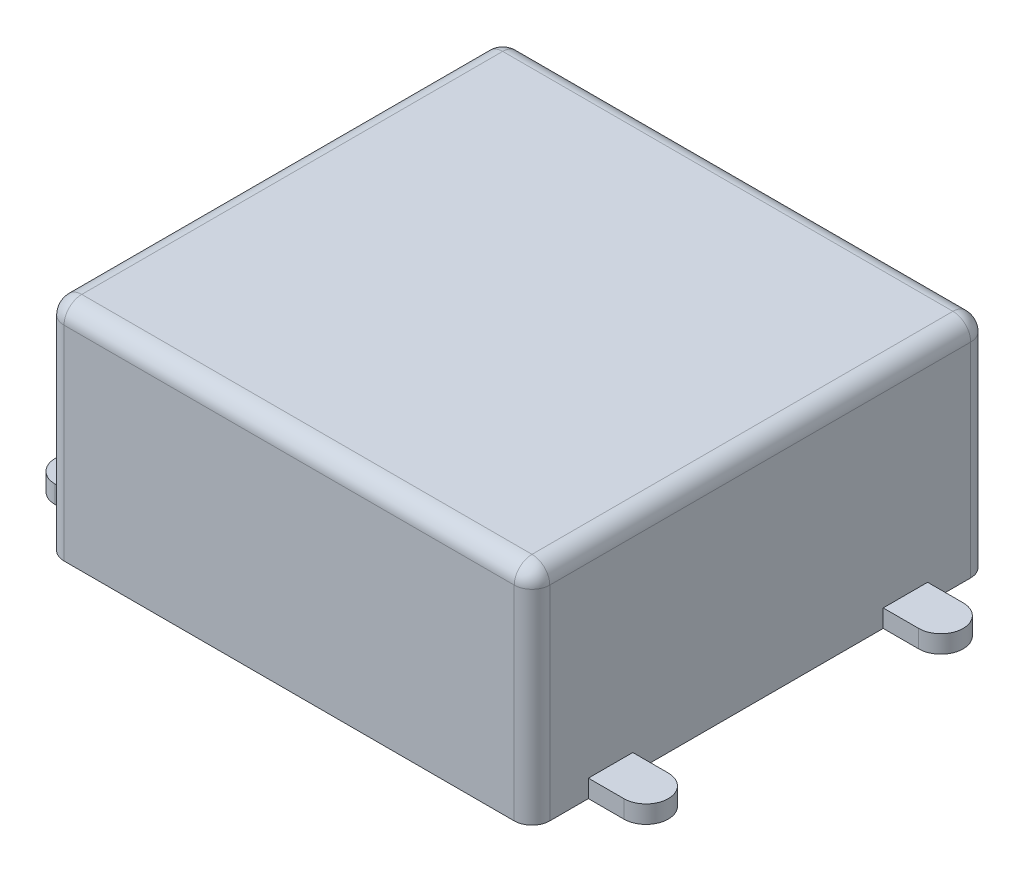
from build123d import *

# Parameters (mm, degrees)
SKETCH1_W           = 54.7
SKETCH1_H           = 51.4
BOSS_EXTRUDE1_DEPTH = 25
FILLET1_R           = 2
SHELL1_T            = -1.6
BOSS_EXTRUDE2_DEPTH = 2
SKETCH2_W           = 9
SKETCH2_H           = 11
CUT_EXTRUDE1_DEPTH  = 70.553217036


with BuildPart() as part:
    # Sketch1 → Boss-Extrude1 (new body)
    with BuildSketch(Plane(origin=(0, 0, 0), x_dir=(1, 0, 0), z_dir=(0, 1, 0))):
        Rectangle(SKETCH1_W, SKETCH1_H)
    extrude(amount=BOSS_EXTRUDE1_DEPTH)

    # Fillet1
    fillet1_edges = [part.edges().sort_by_distance(p)[0] for p in [
        (-27.35, 12.5, -25.7),
        (27.35, 12.5, -25.7),
        (0, 25, -25.7),
        (-27.35, 25, 0),
        (-27.35, 12.5, 25.7),
        (0, 25, 25.7),
        (27.35, 25, 0),
        (27.35, 12.5, 25.7),
    ]]
    fillet(fillet1_edges, radius=FILLET1_R)

    # Shell1
    shell1_openings = [part.faces().sort_by_distance(p)[0] for p in [
        (0, 0, 0),
    ]]
    offset(amount=SHELL1_T, openings=shell1_openings, kind=Kind.INTERSECTION)

    # Sketch1<3> → Boss-Extrude2 (add)
    with BuildSketch(Plane(origin=(0, 0, 0), x_dir=(1, 0, 0), z_dir=(0, 1, 0))):
        with BuildLine():
            Line((31.35, 18.848211449), (27.35, 18.848211449))
            Line((27.35, 18.848211449), (27.35, 13.848211449))
            Line((27.35, 13.848211449), (31.35, 13.848211449))
            ThreePointArc((31.35, 13.848211449), (33.85, 16.348211449), (31.35, 18.848211449))
        make_face()
        with BuildLine():
            Line((-27.35, 15.7), (-27.35, 20.7))
            Line((-27.35, 20.7), (-31.35, 20.7))
            ThreePointArc((-31.35, 20.7), (-33.85, 18.2), (-31.35, 15.7))
            Line((-31.35, 15.7), (-27.35, 15.7))
        make_face()
        with BuildLine():
            Line((31.35, -14.351788551), (27.35, -14.351788551))
            Line((27.35, -14.351788551), (27.35, -19.351788551))
            Line((27.35, -19.351788551), (31.35, -19.351788551))
            ThreePointArc((31.35, -19.351788551), (33.85, -16.851788551), (31.35, -14.351788551))
        make_face()
        with BuildLine():
            Line((-27.35, -20.7), (-27.35, -15.7))
            Line((-27.35, -15.7), (-31.35, -15.7))
            ThreePointArc((-31.35, -15.7), (-33.85, -18.2), (-31.35, -20.7))
            Line((-31.35, -20.7), (-27.35, -20.7))
        make_face()
    extrude(amount=BOSS_EXTRUDE2_DEPTH)

    # Sketch2 → Cut-Extrude1 (cut, through all)
    with BuildSketch(Plane(origin=(-25.75, 0, 0), x_dir=(0, 0, -1), z_dir=(1, 0, 0))):
        with Locations((5, 8.7)):
            Rectangle(SKETCH2_W, SKETCH2_H)
    extrude(amount=-CUT_EXTRUDE1_DEPTH, mode=Mode.SUBTRACT)


solid = part.part
